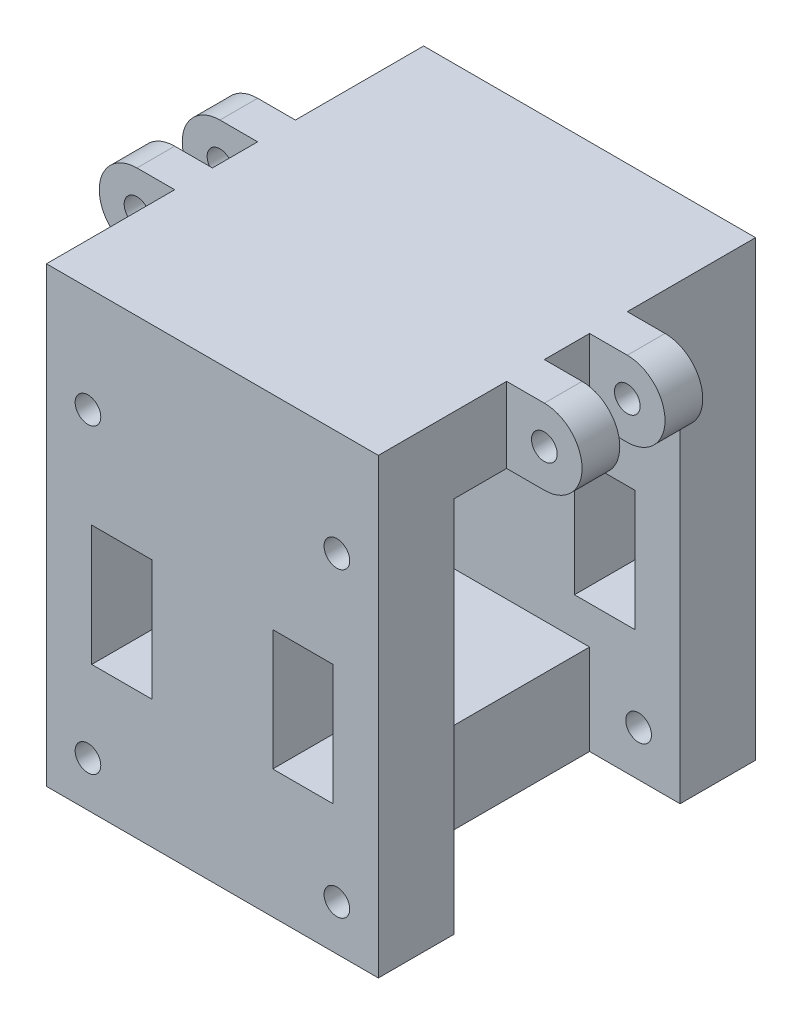
from build123d import *

# Parameters (mm, degrees)
SKETCH1_W           = 50
SKETCH1_H           = 60
BOSS_EXTRUDE1_DEPTH = 50
SKETCH2_W           = 30
SKETCH2_H           = 50
CUT_EXTRUDE1_DEPTH  = 77.811457479
SKETCH3_R           = 1.7
CUT_EXTRUDE2_DEPTH  = 64.442887702
SKETCH4_R           = 1.7
BOSS_EXTRUDE2_DEPTH = 50
CUT_EXTRUDE3_DEPTH  = 17
SKETCH7_W           = 10
SKETCH7_H           = 6
CUT_EXTRUDE4_DEPTH  = 10
SKETCH8_W           = 3
SKETCH8_H           = 17
CUT_EXTRUDE5_DEPTH  = 85.403791384
BOSS_EXTRUDE3_REACH = 61.363
SKETCH10_W          = 20
SKETCH10_H          = 12
SKETCH12_W          = 8
SKETCH12_H          = 16
CUT_EXTRUDE6_DEPTH  = 67.513156593


with BuildPart() as part:
    # Sketch1 → Boss-Extrude1 (new body)
    with BuildSketch(Plane.XY):
        Rectangle(SKETCH1_W, SKETCH1_H)
    extrude(amount=BOSS_EXTRUDE1_DEPTH)

    # Sketch2 → Cut-Extrude1 (cut, through all)
    with BuildSketch(Plane(origin=(25, 0, 0), x_dir=(0, 0, -1), z_dir=(1, 0, 0))):
        with Locations((-25, -5)):
            Rectangle(SKETCH2_W, SKETCH2_H)
    extrude(amount=-CUT_EXTRUDE1_DEPTH, mode=Mode.SUBTRACT)

    # Sketch3 → Cut-Extrude2 (cut, through all)
    with BuildSketch(Plane.XY.offset(50)):
        with Locations((-16.5, -24)):
            Circle(SKETCH3_R)
        with Locations((-16.5, 16)):
            Circle(SKETCH3_R)
        with Locations(Location((16.5, -24, 0), (0, 0, 90))):
            Circle(SKETCH3_R)
        with Locations(Location((16.5, 16, 0), (0, 0, 90))):
            Circle(SKETCH3_R)
    extrude(amount=-CUT_EXTRUDE2_DEPTH, mode=Mode.SUBTRACT)

    # Sketch4 → Boss-Extrude2 (add)
    # profile 1 of 2: a face of its own
    with BuildSketch(Plane.XY.offset(50)):
        with BuildLine():
            Line((-25, 30), (-25, 20))
            Line((-25, 20), (-27, 20))
            ThreePointArc((-27, 20), (-32, 25), (-27, 30))
            Line((-27, 30), (-25, 30))
        make_face()
        with Locations((-27, 25)):
            Circle(SKETCH4_R, mode=Mode.SUBTRACT)
    # profile 2 of 2: a face of its own
    with BuildSketch(Plane.XY.offset(50)):
        with BuildLine():
            Line((27, 30), (25, 30))
            Line((25, 30), (25, 20))
            Line((25, 20), (27, 20))
            ThreePointArc((27, 20), (32, 25), (27, 30))
        make_face()
        with Locations(Location((27, 25, 0), (0, 0, 180))):
            Circle(SKETCH4_R, mode=Mode.SUBTRACT)
    extrude(amount=-BOSS_EXTRUDE2_DEPTH)

    # Sketch6 → Cut-Extrude3 (cut)
    with BuildSketch(Plane.XY.offset(50)):
        with BuildLine():
            Line((25, 30), (25, 20))
            Line((25, 20), (27, 20))
            ThreePointArc((27, 20), (32, 25), (27, 30))
            Line((27, 30), (25, 30))
        make_face()
        with BuildLine():
            Line((-27, 30), (-25, 30))
            Line((-25, 30), (-25, 20))
            Line((-25, 20), (-27, 20))
            ThreePointArc((-27, 20), (-32, 25), (-27, 30))
        make_face()
    cut_extrude3 = extrude(amount=-CUT_EXTRUDE3_DEPTH, mode=Mode.SUBTRACT)

    # Sketch7 → Cut-Extrude4 (cut)
    with BuildSketch(Plane(origin=(0, 30, 0), x_dir=(1, 0, 0), z_dir=(0, 1, 0))):
        with Locations((27, -25)):
            Rectangle(SKETCH7_W, SKETCH7_H)
        with Locations((-27, -25)):
            Rectangle(SKETCH7_W, SKETCH7_H)
    extrude(amount=-CUT_EXTRUDE4_DEPTH, mode=Mode.SUBTRACT)

    # Mirror1: Cut-Extrude3 across plane
    add(cut_extrude3.mirror(Plane(origin=(0, 0, 25), x_dir=(1, 0, 0), z_dir=(0, 0, -1))), mode=Mode.SUBTRACT)

    # Sketch8 → Cut-Extrude5 (cut, through all)
    with BuildSketch(Plane(origin=(0, 30, 0), x_dir=(1, 0, 0), z_dir=(0, 1, 0))):
        with Locations((-23.5, -41.5)):
            Rectangle(SKETCH8_W, SKETCH8_H)
        with Locations((-23.5, -8.5)):
            Rectangle(SKETCH8_W, SKETCH8_H)
        with Locations((23.5, -41.5)):
            Rectangle(SKETCH8_W, SKETCH8_H)
        with Locations((23.5, -8.5)):
            Rectangle(SKETCH8_W, SKETCH8_H)
    extrude(amount=-CUT_EXTRUDE5_DEPTH, mode=Mode.SUBTRACT)

    # Sketch10 → Boss-Extrude3 (add, up to next)
    with BuildSketch(Plane.XY.offset(10), mode=Mode.PRIVATE) as boss_extrude3_sk1:
        with Locations((0, -24)):
            Rectangle(SKETCH10_W, SKETCH10_H)
    boss_extrude3_tool1 = extrude(boss_extrude3_sk1.sketch, amount=BOSS_EXTRUDE3_REACH, mode=Mode.PRIVATE) - part.part
    add(boss_extrude3_tool1.solids().sort_by_distance((0, -24, 10))[0])

    # Sketch12 → Cut-Extrude6 (cut, through all)
    with BuildSketch(Plane.XY.offset(50)):
        with Locations((-12, -5)):
            Rectangle(SKETCH12_W, SKETCH12_H)
        with Locations((12, -5)):
            Rectangle(SKETCH12_W, SKETCH12_H)
    extrude(amount=-CUT_EXTRUDE6_DEPTH, mode=Mode.SUBTRACT)


solid = part.part
